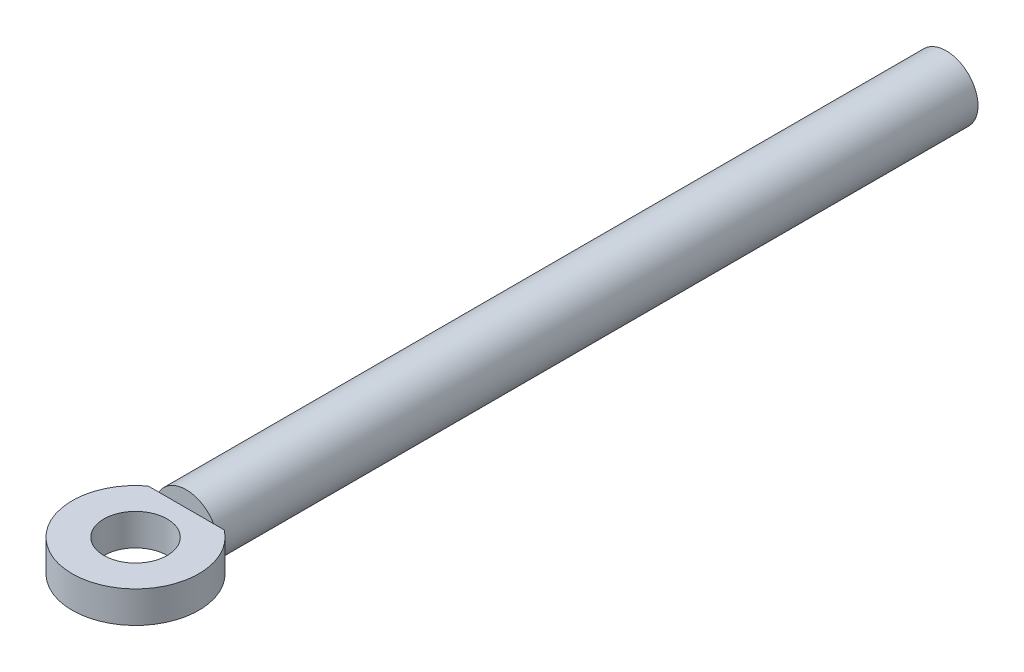
from build123d import *

# Parameters (mm, degrees)
SKETCH1_R           = 6.35
BOSS_EXTRUDE1_DEPTH = 152.4
SKETCH2_W           = 25.4
SKETCH2_H           = 6.35
BOSS_EXTRUDE2_DEPTH = 22.86
SKETCH3_R           = 6.35
CUT_EXTRUDE1_DEPTH  = 22.86


with BuildPart() as part:
    # Sketch1 → Boss-Extrude1 (new body)
    with BuildSketch(Plane.XY):
        Circle(SKETCH1_R)
    extrude(amount=BOSS_EXTRUDE1_DEPTH)

    # Sketch2 → Boss-Extrude2 (add)
    with BuildSketch(Plane.XY.offset(152.4)):
        Rectangle(SKETCH2_W, SKETCH2_H)
    extrude(amount=BOSS_EXTRUDE2_DEPTH)

    # Sketch3 → Cut-Extrude1 (cut)
    with BuildSketch(Plane(origin=(0, 3.175, 0), x_dir=(1, 0, 0), z_dir=(0, 1, 0))):
        with Locations((0, -162.56)):
            Circle(SKETCH3_R)
        with BuildLine():
            ThreePointArc((12.7, -162.56), (8.980256121, -171.540256121), (0, -175.26))
            Line((0, -175.26), (12.7, -175.26))
            Line((12.7, -175.26), (12.7, -162.56))
        make_face()
        with BuildLine():
            Line((-12.7, -175.26), (0, -175.26))
            ThreePointArc((0, -175.26), (-8.980256121, -171.540256121), (-12.7, -162.56))
            Line((-12.7, -162.56), (-12.7, -175.26))
        make_face()
        with BuildLine():
            ThreePointArc((7.62, -152.4), (11.359225326, -156.880387337), (12.7, -162.56))
            Line((12.7, -162.56), (12.7, -152.4))
            Line((12.7, -152.4), (7.62, -152.4))
        make_face()
        with BuildLine():
            Line((-12.7, -152.4), (-12.7, -162.56))
            ThreePointArc((-12.7, -162.56), (-11.359225326, -156.880387337), (-7.62, -152.4))
            Line((-7.62, -152.4), (-12.7, -152.4))
        make_face()
    extrude(amount=-CUT_EXTRUDE1_DEPTH, mode=Mode.SUBTRACT)


solid = part.part
